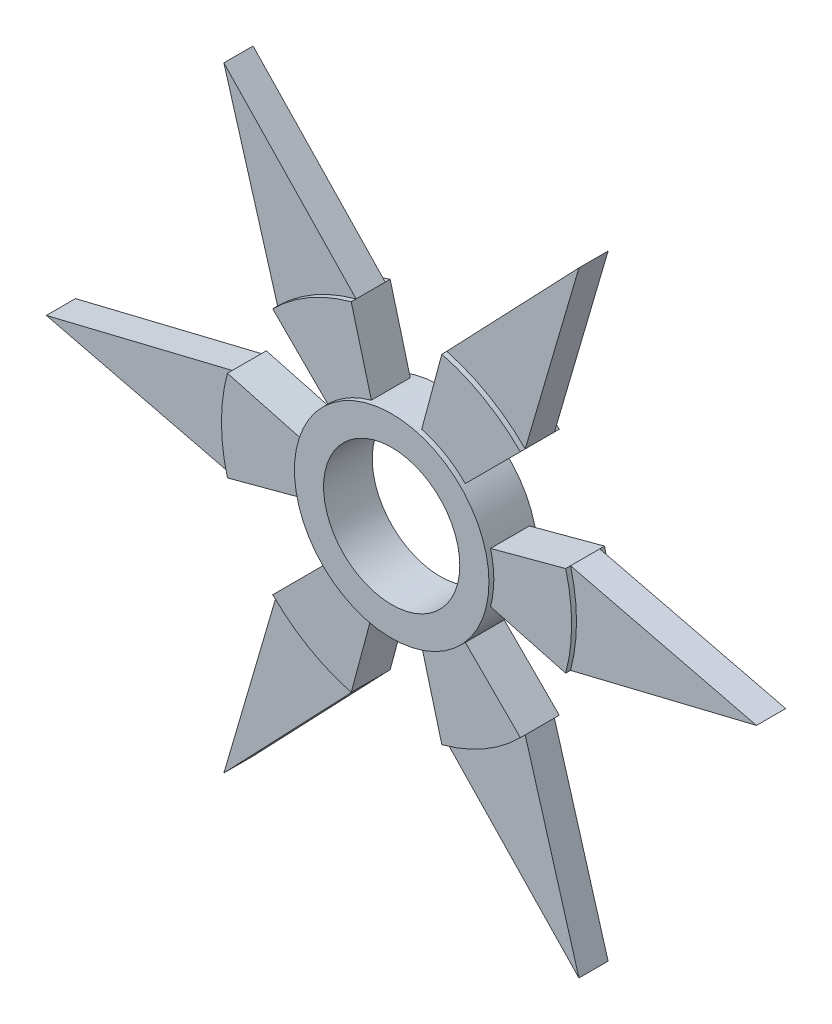
from build123d import *

# Parameters (mm, degrees)
SKETCH1_R           = 14
BOSS_EXTRUDE1_DEPTH = 5
BOSS_EXTRUDE2_DEPTH = 4
BOSS_EXTRUDE3_DEPTH = 3


with BuildPart() as part:
    # Sketch1 → Boss-Extrude1 (new, symmetric)
    with BuildSketch(Plane.XY):
        with BuildLine():
            ThreePointArc((20, 0), (19.828897227, 2.610523844), (19.318516526, 5.176380902))
            ThreePointArc((19.318516526, 5.176380902), (17.320508076, 10), (14.142135624, 14.142135624))
            ThreePointArc((14.142135624, 14.142135624), (10, 17.320508076), (5.176380902, 19.318516526))
            ThreePointArc((5.176380902, 19.318516526), (0, 20), (-5.176380902, 19.318516526))
            ThreePointArc((-5.176380902, 19.318516526), (-10, 17.320508076), (-14.142135624, 14.142135624))
            ThreePointArc((-14.142135624, 14.142135624), (-17.320508076, 10), (-19.318516526, 5.176380902))
            ThreePointArc((-19.318516526, 5.176380902), (-20, 0), (-19.318516526, -5.176380902))
            ThreePointArc((-19.318516526, -5.176380902), (-17.320508076, -10), (-14.142135624, -14.142135624))
            ThreePointArc((-14.142135624, -14.142135624), (-10, -17.320508076), (-5.176380902, -19.318516526))
            ThreePointArc((-5.176380902, -19.318516526), (0, -20), (5.176380902, -19.318516526))
            ThreePointArc((5.176380902, -19.318516526), (10, -17.320508076), (14.142135624, -14.142135624))
            ThreePointArc((14.142135624, -14.142135624), (17.320508076, -10), (19.318516526, -5.176380902))
            ThreePointArc((19.318516526, -5.176380902), (19.828897227, -2.610523844), (20, 0))
        make_face()
        Circle(SKETCH1_R, mode=Mode.SUBTRACT)
    extrude(amount=BOSS_EXTRUDE1_DEPTH, both=True)

    # Sketch1<3> → Boss-Extrude2 (add, symmetric)
    with BuildSketch(Plane.XY):
        with BuildLine():
            Line((34.773329746, 9.317485624), (19.318516526, 5.176380902))
            ThreePointArc((19.318516526, 5.176380902), (20, 0), (19.318516526, -5.176380902))
            Line((19.318516526, -5.176380902), (34.773329746, -9.317485624))
            ThreePointArc((34.773329746, -9.317485624), (36, 0), (34.773329746, 9.317485624))
        make_face()
        with BuildLine():
            ThreePointArc((5.176380902, 19.318516526), (10, 17.320508076), (14.142135624, 14.142135624))
            Line((14.142135624, 14.142135624), (25.455844123, 25.455844123))
            ThreePointArc((25.455844123, 25.455844123), (18, 31.176914536), (9.317485624, 34.773329746))
            Line((9.317485624, 34.773329746), (5.176380902, 19.318516526))
        make_face()
        with BuildLine():
            Line((25.455844123, -25.455844123), (14.142135624, -14.142135624))
            ThreePointArc((14.142135624, -14.142135624), (10, -17.320508076), (5.176380902, -19.318516526))
            Line((5.176380902, -19.318516526), (9.317485624, -34.773329746))
            ThreePointArc((9.317485624, -34.773329746), (18, -31.176914536), (25.455844123, -25.455844123))
        make_face()
        with BuildLine():
            ThreePointArc((-14.142135624, 14.142135624), (-10, 17.320508076), (-5.176380902, 19.318516526))
            Line((-5.176380902, 19.318516526), (-9.317485624, 34.773329746))
            ThreePointArc((-9.317485624, 34.773329746), (-18, 31.176914536), (-25.455844123, 25.455844123))
            Line((-25.455844123, 25.455844123), (-14.142135624, 14.142135624))
        make_face()
        with BuildLine():
            Line((-9.317485624, -34.773329746), (-5.176380902, -19.318516526))
            ThreePointArc((-5.176380902, -19.318516526), (-10, -17.320508076), (-14.142135624, -14.142135624))
            Line((-14.142135624, -14.142135624), (-25.455844123, -25.455844123))
            ThreePointArc((-25.455844123, -25.455844123), (-18, -31.176914536), (-9.317485624, -34.773329746))
        make_face()
        with BuildLine():
            ThreePointArc((-19.318516526, -5.176380902), (-20, 0), (-19.318516526, 5.176380902))
            Line((-19.318516526, 5.176380902), (-34.773329746, 9.317485624))
            ThreePointArc((-34.773329746, 9.317485624), (-36, 0), (-34.773329746, -9.317485624))
            Line((-34.773329746, -9.317485624), (-19.318516526, -5.176380902))
        make_face()
    extrude(amount=BOSS_EXTRUDE2_DEPTH, both=True)

    # Sketch1<4> → Boss-Extrude3 (add, symmetric)
    with BuildSketch(Plane.XY):
        with BuildLine():
            Line((73, 0), (34.773329746, 9.317485624))
            ThreePointArc((34.773329746, 9.317485624), (36, 0), (34.773329746, -9.317485624))
            Line((34.773329746, -9.317485624), (73, 0))
        make_face()
        with BuildLine():
            ThreePointArc((9.317485624, 34.773329746), (18, 31.176914536), (25.455844123, 25.455844123))
            Line((25.455844123, 25.455844123), (36.5, 63.219854476))
            Line((36.5, 63.219854476), (9.317485624, 34.773329746))
        make_face()
        with BuildLine():
            Line((36.5, -63.219854476), (25.455844123, -25.455844123))
            ThreePointArc((25.455844123, -25.455844123), (18, -31.176914536), (9.317485624, -34.773329746))
            Line((9.317485624, -34.773329746), (36.5, -63.219854476))
        make_face()
        with BuildLine():
            ThreePointArc((-25.455844123, 25.455844123), (-18, 31.176914536), (-9.317485624, 34.773329746))
            Line((-9.317485624, 34.773329746), (-36.5, 63.219854476))
            Line((-36.5, 63.219854476), (-25.455844123, 25.455844123))
        make_face()
        with BuildLine():
            Line((-36.5, -63.219854476), (-9.317485624, -34.773329746))
            ThreePointArc((-9.317485624, -34.773329746), (-18, -31.176914536), (-25.455844123, -25.455844123))
            Line((-25.455844123, -25.455844123), (-36.5, -63.219854476))
        make_face()
        with BuildLine():
            ThreePointArc((-34.773329746, -9.317485624), (-36, 0), (-34.773329746, 9.317485624))
            Line((-34.773329746, 9.317485624), (-73, 0))
            Line((-73, 0), (-34.773329746, -9.317485624))
        make_face()
    extrude(amount=BOSS_EXTRUDE3_DEPTH, both=True)


solid = part.part
